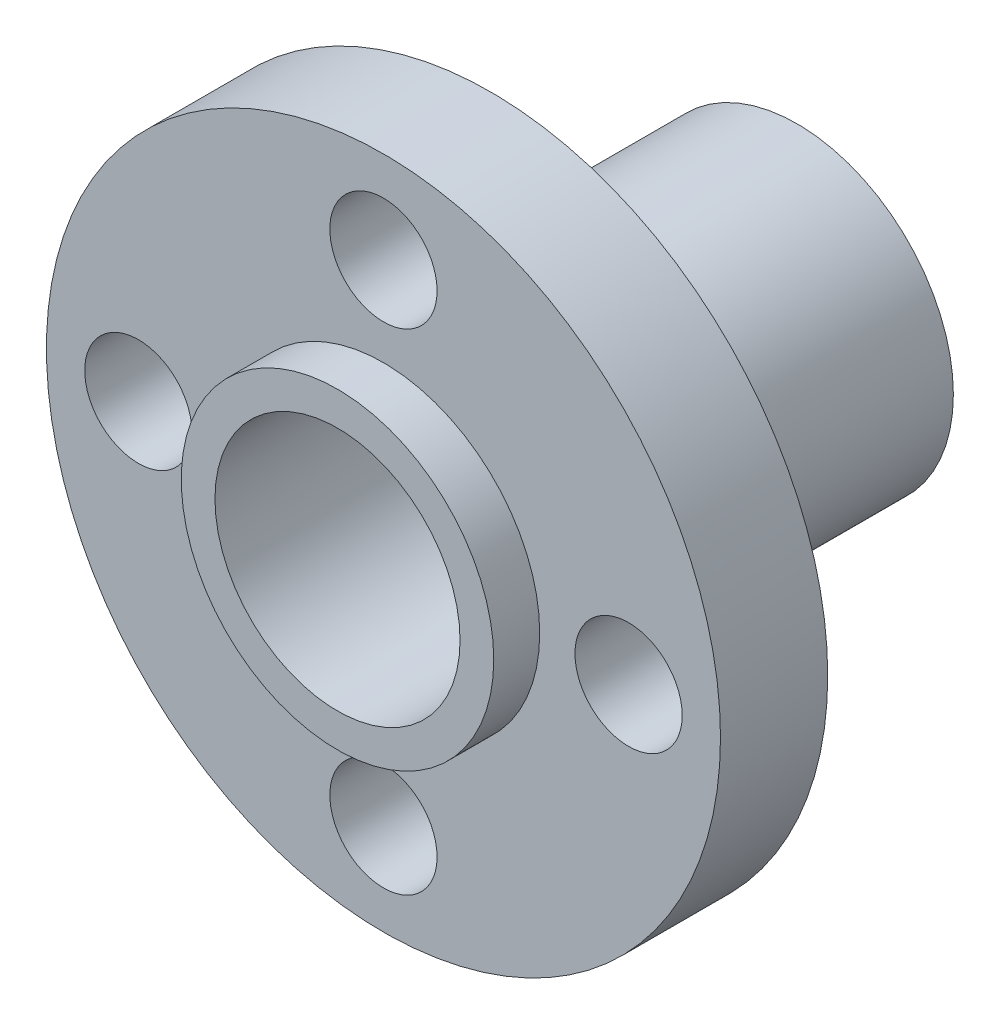
from build123d import *

# Parameters (mm, degrees)
ESBO_O1_R                = 11
ESBO_O1_R_2              = 4
ESBO_O1_R_3              = 1.75
RESSALTO_EXTRUS_O1_DEPTH = 3.5
RESSALTO_EXTRUS_O2_START = 3.5
ESBO_O1_3_R              = 5.1
ESBO_O1_3_R_2            = 4
RESSALTO_EXTRUS_O2_DEPTH = 1.5
RESSALTO_EXTRUS_O3_START = -10
ESBO_O1_5_R              = 5.1
ESBO_O1_5_R_2            = 4
RESSALTO_EXTRUS_O3_DEPTH = 10


with BuildPart() as part:
    # Esboço1 → Ressalto-extrusão1 (new body)
    with BuildSketch(Plane.XY):
        Circle(ESBO_O1_R)
        Circle(ESBO_O1_R_2, mode=Mode.SUBTRACT)
        with Locations((-8, 0)):
            Circle(ESBO_O1_R_3, mode=Mode.SUBTRACT)
        with Locations((0, 8)):
            Circle(ESBO_O1_R_3, mode=Mode.SUBTRACT)
        with Locations((8, 0)):
            Circle(ESBO_O1_R_3, mode=Mode.SUBTRACT)
        with Locations((0, -8)):
            Circle(ESBO_O1_R_3, mode=Mode.SUBTRACT)
    extrude(amount=RESSALTO_EXTRUS_O1_DEPTH)

    # Esboço1<3> → Ressalto-extrusão2 (add)
    with BuildSketch(Plane.XY.offset(RESSALTO_EXTRUS_O2_START)):
        Circle(ESBO_O1_3_R)
        Circle(ESBO_O1_3_R_2, mode=Mode.SUBTRACT)
    extrude(amount=RESSALTO_EXTRUS_O2_DEPTH)

    # Esboço1<5> → Ressalto-extrusão3 (add)
    with BuildSketch(Plane.XY.offset(RESSALTO_EXTRUS_O3_START)):
        Circle(ESBO_O1_5_R)
        Circle(ESBO_O1_5_R_2, mode=Mode.SUBTRACT)
    extrude(amount=RESSALTO_EXTRUS_O3_DEPTH)


solid = part.part
